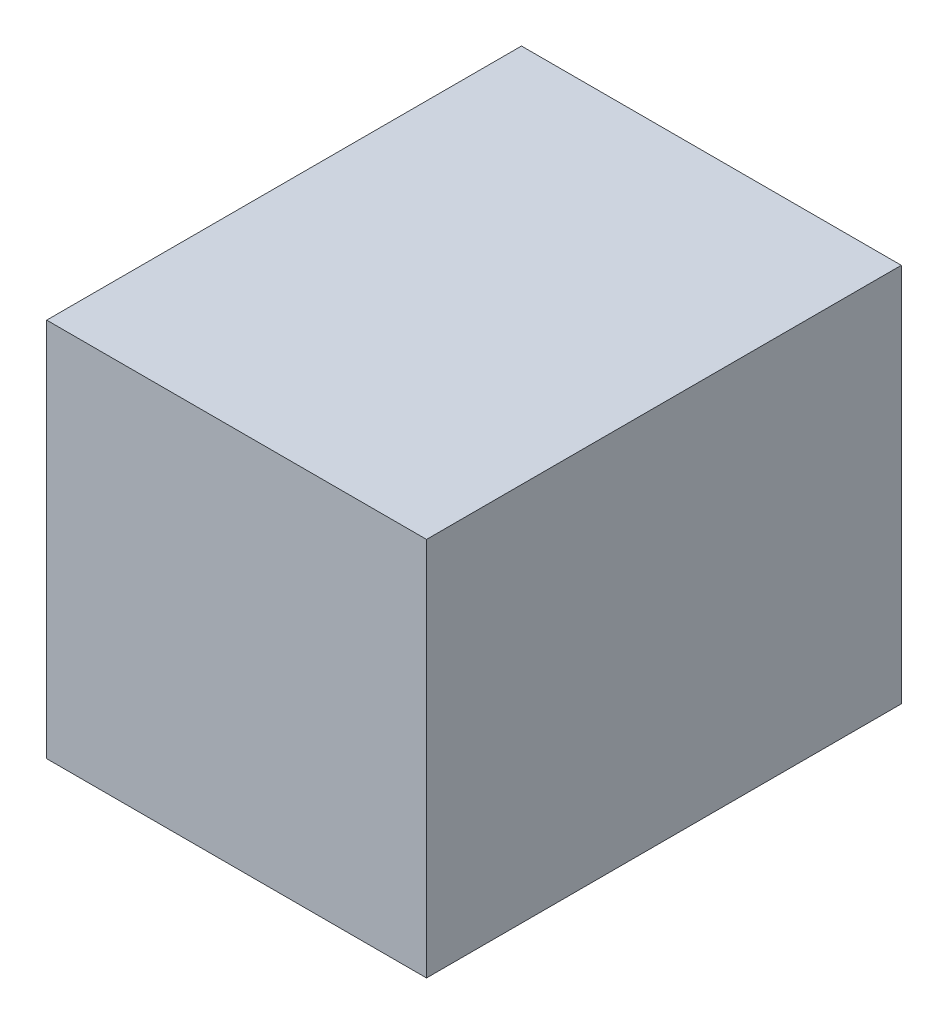
from build123d import *

# Parameters (mm, degrees)
ESQUISSE1_W        = 8
ESQUISSE1_H        = 8
BOSS_EXTRU_1_DEPTH = 10


with BuildPart() as part:
    # Esquisse1 → Boss.-Extru.1 (new body)
    with BuildSketch(Plane.XY):
        with Locations((4, 4)):
            Rectangle(ESQUISSE1_W, ESQUISSE1_H)
    extrude(amount=BOSS_EXTRU_1_DEPTH)


solid = part.part
